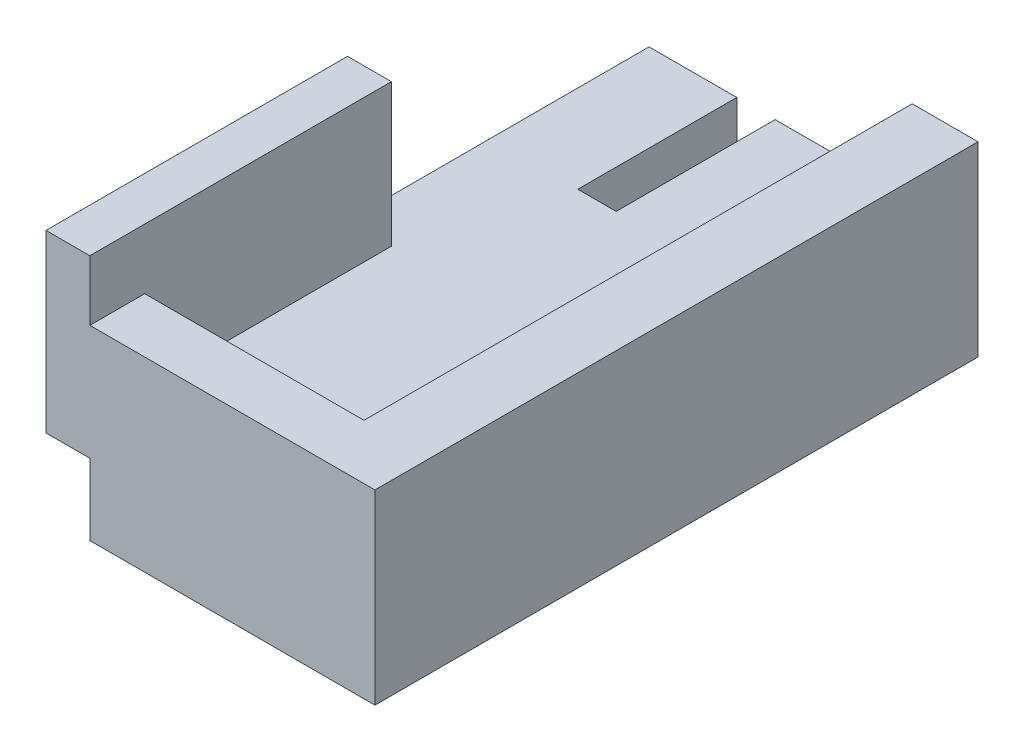
from build123d import *

# Parameters (mm, degrees)
EXTRUDE_1_DEPTH          = 110
SKETCH_2_W               = 8
SKETCH_2_H               = 13
CUT_EXTRUDE_1_DEPTH      = 14
CUT_EXTRUDE_4_DEPTH      = 120.63381629
CUT_EXTRUDE_4_DEPTH_BACK = 15
SKETCH_4_W               = 8
SKETCH_4_H               = 55
SKETCH_5_W               = 7
SKETCH_5_H               = 7
CUT_EXTRUDE_5_DEPTH      = 29
SKETCH_3_W               = 25
SKETCH_3_H               = 6
CUT_EXTRUDE_6_DEPTH      = 10
SKETCH_6_W               = 5
SKETCH_6_H               = 110
CUT_EXTRUDE_7_DEPTH      = 119.30997422


with BuildPart() as part:
    # Эскиз1 → Бобышка-Вытянуть1 (new body)
    with BuildSketch(Plane.XY):
        Polygon((-32.5, 22.5), (-32.5, -22.5), (32.5, -22.5), (32.5, -6.5), (27.5, -6.5), (27.5, 11.5), (-24.5, 11.5), (-24.5, 22.5), align=None)
    extrude(amount=EXTRUDE_1_DEPTH)

    # Эскиз2 → Вырез-Вытянуть1 (cut)
    with BuildSketch(Plane.XY.offset(110)):
        with Locations((-28.5, -16)):
            Rectangle(SKETCH_2_W, SKETCH_2_H)
    extrude(amount=-CUT_EXTRUDE_1_DEPTH, mode=Mode.SUBTRACT)

    # Эскиз4 → Вырез-Вытянуть4 (cut, two sides: drawn at the far end of the back side and taken through both)
    with BuildSketch(Plane(origin=(0, 11.5, 0), x_dir=(1, 0, 0), z_dir=(0, 1, 0)).offset(-CUT_EXTRUDE_4_DEPTH_BACK)):
        Polygon((-24.5, -55), (-24.5, -100), (15.5, -100), (15.5, 0), (-24.5, 0), align=None)
        with Locations((-28.5, -27.5)):
            Rectangle(SKETCH_4_W, SKETCH_4_H)
    extrude(amount=CUT_EXTRUDE_4_DEPTH + CUT_EXTRUDE_4_DEPTH_BACK, mode=Mode.SUBTRACT)

    # Эскиз5 → Вырез-Вытянуть5 (cut)
    with BuildSketch(Plane(origin=(0, 0, 0), x_dir=(-1, 0, 0), z_dir=(0, 0, -1))):
        with Locations((13, -7)):
            Rectangle(SKETCH_5_W, SKETCH_5_H)
    extrude(amount=-CUT_EXTRUDE_5_DEPTH, mode=Mode.SUBTRACT)

    # Эскиз3 → Вырез-Вытянуть6 (cut)
    with BuildSketch(Plane(origin=(-32.5, 0, 0), x_dir=(0, 0, -1), z_dir=(1, 0, 0))):
        with Locations((-55, -19.5)):
            Rectangle(SKETCH_3_W, SKETCH_3_H)
    extrude(amount=CUT_EXTRUDE_6_DEPTH, mode=Mode.SUBTRACT)

    # Эскиз6 → Вырез-Вытянуть7 (cut, through all)
    with BuildSketch(Plane(origin=(0, -6.5, 0), x_dir=(1, 0, 0), z_dir=(0, 1, 0))):
        with Locations((30, -55)):
            Rectangle(SKETCH_6_W, SKETCH_6_H)
    extrude(amount=-CUT_EXTRUDE_7_DEPTH, mode=Mode.SUBTRACT)


solid = part.part
